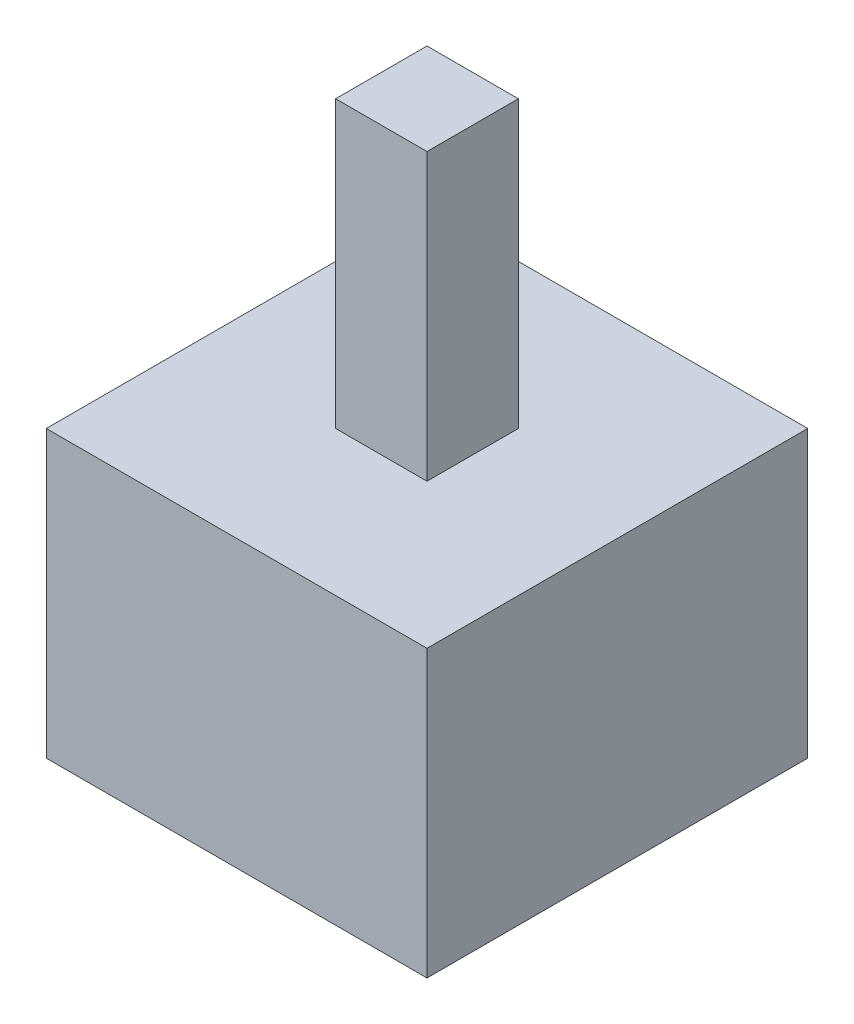
from build123d import *

# Parameters (mm, degrees)
SKETCH1_W           = 12.7
SKETCH1_H           = 12.7
BOSS_EXTRUDE1_DEPTH = 9.525
SKETCH3_W           = 3.048
SKETCH3_H           = 3.048
BOSS_EXTRUDE2_DEPTH = 9.525
SKETCH4_R           = 3.175
CUT_EXTRUDE1_DEPTH  = 6.35


with BuildPart() as part:
    # Sketch1 → Boss-Extrude1 (new body)
    with BuildSketch(Plane(origin=(0, 0, 0), x_dir=(1, 0, 0), z_dir=(0, 1, 0))):
        Rectangle(SKETCH1_W, SKETCH1_H)
    extrude(amount=BOSS_EXTRUDE1_DEPTH)

    # Sketch3 → Boss-Extrude2 (add)
    with BuildSketch(Plane(origin=(0, 9.525, 0), x_dir=(1, 0, 0), z_dir=(0, 1, 0))):
        Rectangle(SKETCH3_W, SKETCH3_H)
    extrude(amount=BOSS_EXTRUDE2_DEPTH)

    # Sketch4 → Cut-Extrude1 (cut)
    with BuildSketch(Plane.XZ):
        with Locations(Location((0, 0, 0), (0, 0, 270))):
            Circle(SKETCH4_R)
    extrude(amount=-CUT_EXTRUDE1_DEPTH, mode=Mode.SUBTRACT)


solid = part.part
